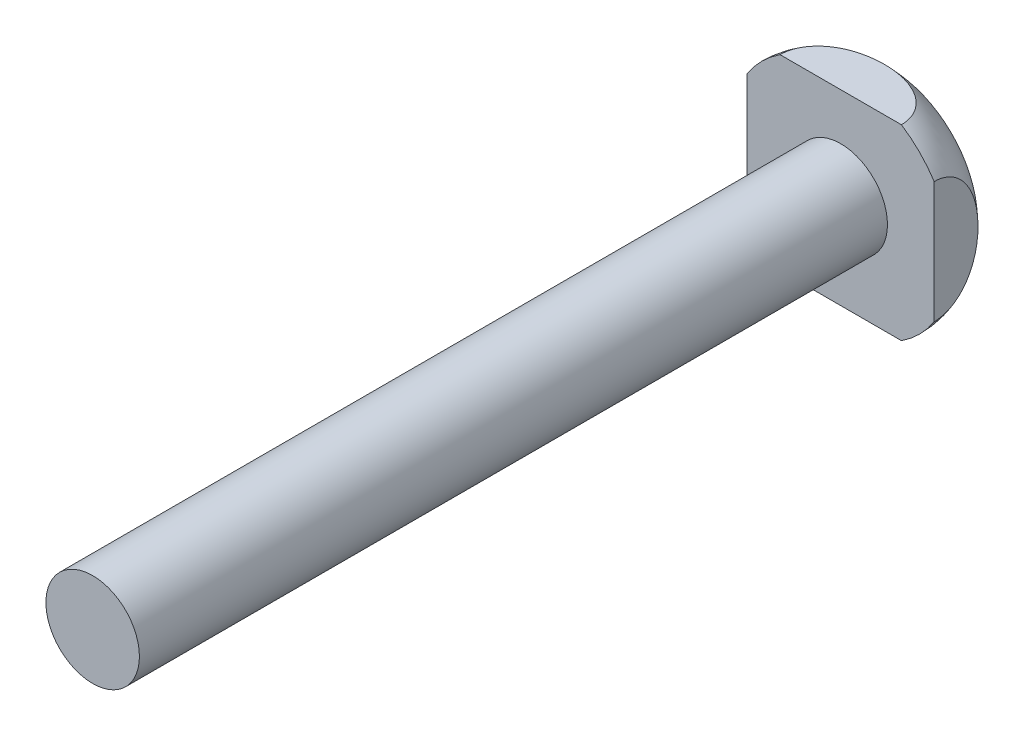
from build123d import *

# Parameters (mm, degrees)
SKETCH1_W           = 24
SKETCH1_H           = 24
BOSS_EXTRUDE2_DEPTH = 4
SKETCH3_R           = 6
BOSS_EXTRUDE3_DEPTH = 96


with BuildPart() as part:
    # Sketch1 → Boss-Extrude2 (new, symmetric)
    with BuildSketch(Plane.XY):
        Rectangle(SKETCH1_W, SKETCH1_H)
    extrude(amount=BOSS_EXTRUDE2_DEPTH, both=True)

    # Sketch3 → Boss-Extrude3 (add)
    with BuildSketch(Plane.XY.offset(4)):
        Circle(SKETCH3_R)
    extrude(amount=BOSS_EXTRUDE3_DEPTH)

    # Sketch5 → Cut-Revolve8 (revolve, cut)
    with BuildSketch(Plane(origin=(0, 0, 0), x_dir=(1, 0, 0), z_dir=(0, 1, 0)), mode=Mode.PRIVATE) as cut_revolve8_sk:
        with BuildLine():
            Line((0, 4), (6.30628562, 4))
            ThreePointArc((6.30628562, 4), (11.96313987, 1.656854249), (14.30628562, -4))
            Line((14.30628562, -4), (24.30628562, -4))
            ThreePointArc((24.30628562, -4), (15.122793398, 9.010065299), (0, 14))
            Line((0, 14), (0, 4))
        make_face()
    revolve(cut_revolve8_sk.sketch.rotate(Axis((0, 0, -4), (0, 0, 1)), 180), axis=Axis((0, 0, -4), (0, 0, 1)), mode=Mode.SUBTRACT)


solid = part.part
